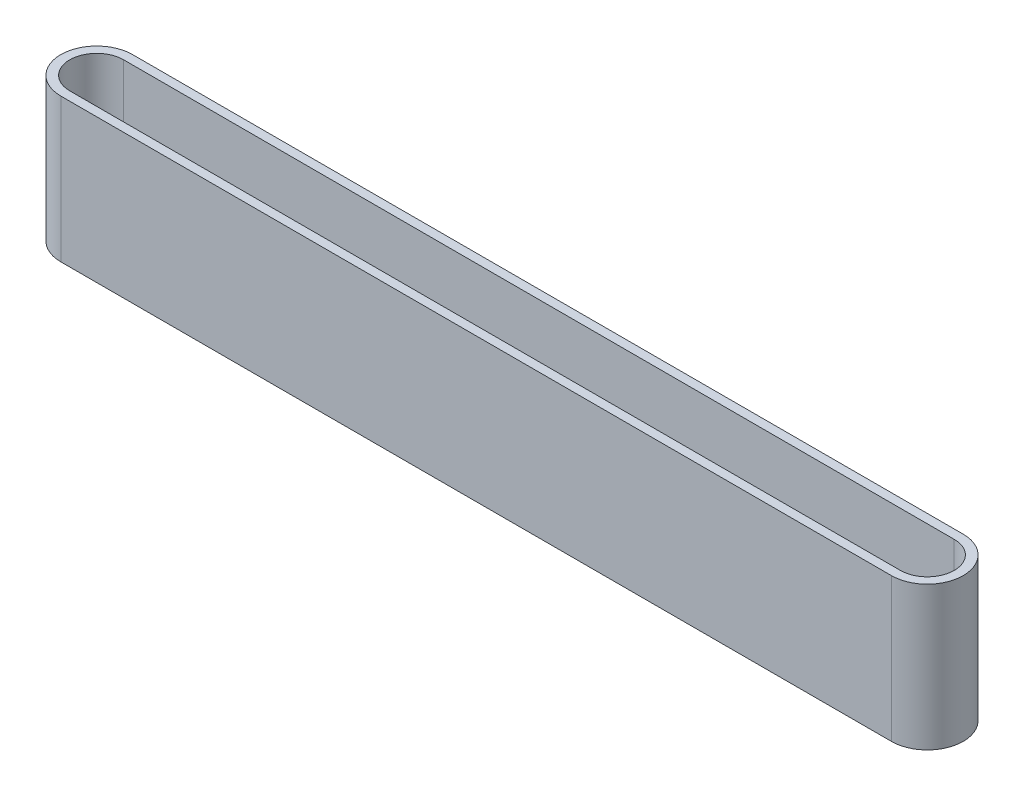
from build123d import *

# Parameters (mm, degrees)
EXTRUDE_THIN1_DEPTH = 16


with BuildPart() as part:
    # Sketch1 → Extrude-Thin1 (new body)
    with BuildSketch(Plane(origin=(0, 0, 0), x_dir=(1, 0, 0), z_dir=(0, 1, 0))):
        with BuildLine():
            Line((53.002319676, -4), (-39.547680324, -4))
            ThreePointArc((-39.547680324, -4), (-43.547680324, 0), (-39.547680324, 4))
            Line((-39.547680324, 4), (53.002319676, 4))
            ThreePointArc((53.002319676, 4), (57.002319676, 0), (53.002319676, -4))
        make_face()
        with BuildLine():
            Line((53.002319676, -3), (-39.547680324, -3))
            ThreePointArc((-39.547680324, -3), (-42.547680324, 0), (-39.547680324, 3))
            Line((-39.547680324, 3), (53.002319676, 3))
            ThreePointArc((53.002319676, 3), (56.002319676, 0), (53.002319676, -3))
        make_face(mode=Mode.SUBTRACT)
    extrude(amount=EXTRUDE_THIN1_DEPTH)


solid = part.part
